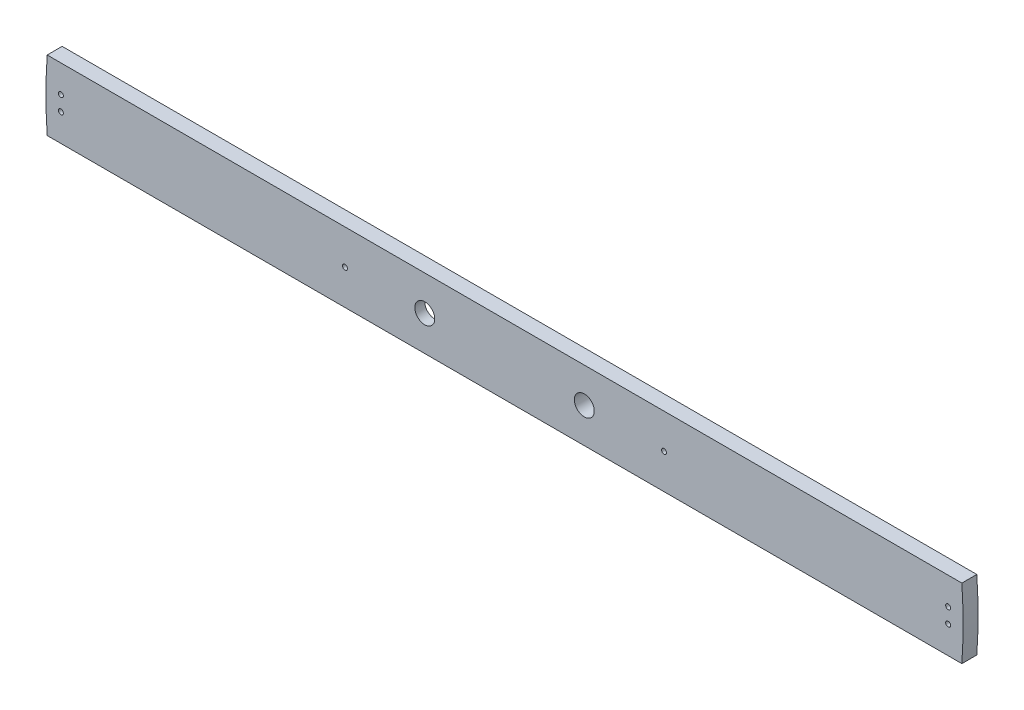
from build123d import *

# Parameters (mm, degrees)
SKETCH1_R           = 12.7
SKETCH1_R_2         = 3.175
BOSS_EXTRUDE2_DEPTH = 19.05
SKETCH2_W           = 40.64
SKETCH2_H           = 127
CUT_EXTRUDE1_DEPTH  = 6.35


with BuildPart() as part:
    # Sketch1 → Boss-Extrude2 (new body)
    with BuildSketch(Plane.XY):
        with BuildLine():
            Line((582.506512839, 44.45), (-582.506512839, 44.45))
            ThreePointArc((-582.506512839, 44.45), (-584.2, 0), (-582.506512839, -44.45))
            Line((-582.506512839, -44.45), (582.506512839, -44.45))
            ThreePointArc((582.506512839, -44.45), (584.2, 0), (582.506512839, 44.45))
        make_face()
        with Locations(Location((101.6, 0, 0), (0, 0, 180))):
            Circle(SKETCH1_R, mode=Mode.SUBTRACT)
        with Locations(Location((-565.069727445, 9.525, 0), (0, 0, 180))):
            Circle(SKETCH1_R_2, mode=Mode.SUBTRACT)
        with Locations(Location((-565.069727445, -9.525, 0), (0, 0, 180))):
            Circle(SKETCH1_R_2, mode=Mode.SUBTRACT)
        with Locations(Location((565.069727445, -9.525, 0), (0, 0, 180))):
            Circle(SKETCH1_R_2, mode=Mode.SUBTRACT)
        with Locations(Location((565.069727445, 9.525, 0), (0, 0, 180))):
            Circle(SKETCH1_R_2, mode=Mode.SUBTRACT)
        with Locations(Location((-101.6, 0, 0), (0, 0, 180))):
            Circle(SKETCH1_R, mode=Mode.SUBTRACT)
        with Locations(Location((-203.2, 0, 0), (0, 0, 180))):
            Circle(SKETCH1_R_2, mode=Mode.SUBTRACT)
        with Locations(Location((203.2, 0, 0), (0, 0, 180))):
            Circle(SKETCH1_R_2, mode=Mode.SUBTRACT)
    extrude(amount=BOSS_EXTRUDE2_DEPTH)

    # Sketch2 → Cut-Extrude1 (cut)
    with BuildSketch(Plane.XY):
        with Locations((-101.6, -44.45)):
            Rectangle(SKETCH2_W, SKETCH2_H)
    extrude(amount=CUT_EXTRUDE1_DEPTH, mode=Mode.SUBTRACT)


solid = part.part
